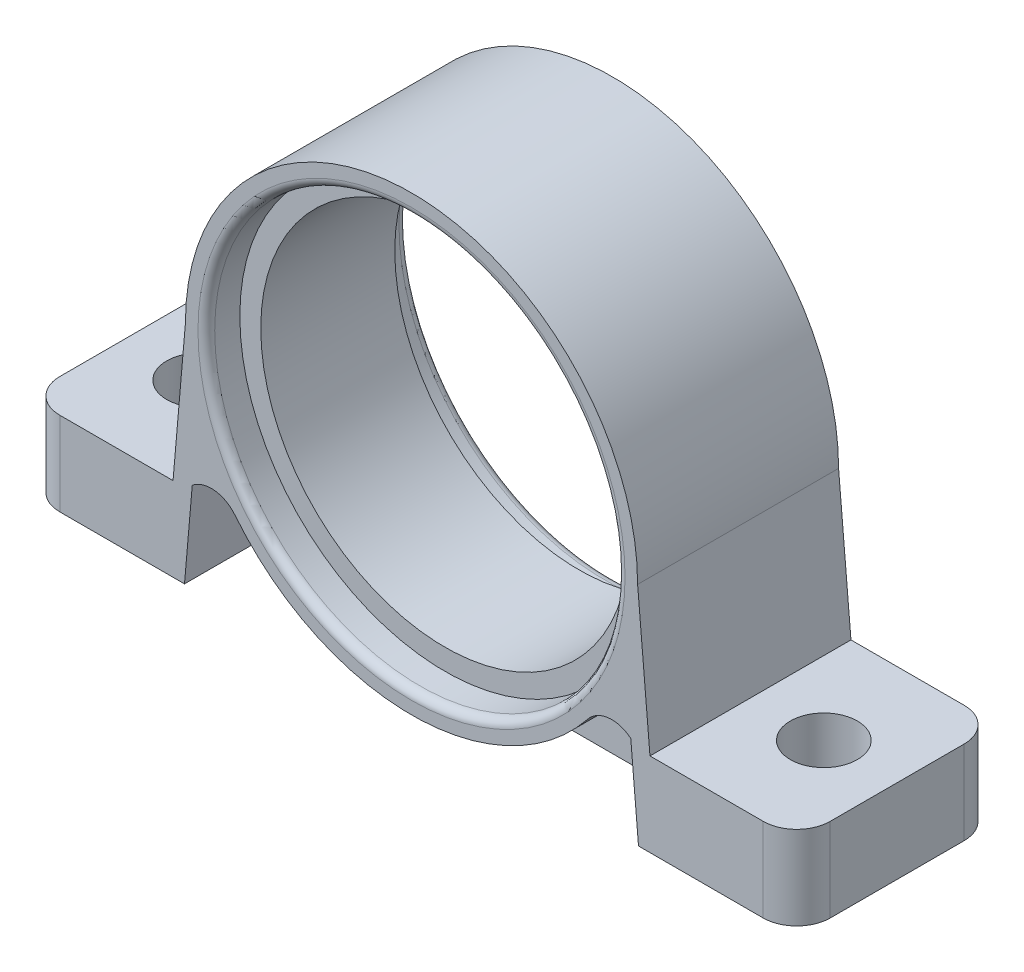
from build123d import *

# Parameters (mm, degrees)
CROQUIS1_R              = 11
SALIENTE_EXTRUIR1_DEPTH = 6
CROQUIS2_R              = 2
CORTAR_EXTRUIR1_DEPTH   = 33.388269481
CORTAR_EXTRUIR2_DEPTH   = 30.244657632
SALIENTE_EXTRUIR2_DEPTH = 2
CROQUIS6_R              = 12.25
CORTAR_EXTRUIR3_DEPTH   = 2
CORTAR_EXTRUIR4_START   = -2
CROQUIS7_R              = 12.25
CORTAR_EXTRUIR4_DEPTH   = 2
REDONDEO1_R             = 2
REDONDEO2_R             = 2
REDONDEO3_R             = 2
REDONDEO4_R             = 0.5


with BuildPart() as part:
    # Croquis1 → Saliente-Extruir1 (new, symmetric)
    with BuildSketch(Plane.XY):
        with BuildLine():
            Line((23, -13.5), (-23, -13.5))
            Line((-23, -13.5), (-23, -8.5))
            Line((-23, -8.5), (-14.237940292, -8.5))
            Line((-14.237940292, -8.5), (-13.5, 0))
            ThreePointArc((-13.5, 0), (0, 13.5), (13.5, 0))
            Line((13.5, 0), (14.237940292, -8.5))
            Line((14.237940292, -8.5), (23, -8.5))
            Line((23, -8.5), (23, -13.5))
        make_face()
        Circle(CROQUIS1_R, mode=Mode.SUBTRACT)
    extrude(amount=SALIENTE_EXTRUIR1_DEPTH, both=True)

    # Croquis2 → Cortar-Extruir1 (cut, through all)
    with BuildSketch(Plane(origin=(0, -8.5, 0), x_dir=(1, 0, 0), z_dir=(0, 1, 0))):
        with Locations(Location((-18.618970146, 0, 0), (0, 0, 270))):
            Circle(CROQUIS2_R)
        with Locations(Location((18.618970146, 0, 0), (0, 0, 90))):
            Circle(CROQUIS2_R)
    extrude(amount=-CORTAR_EXTRUIR1_DEPTH, mode=Mode.SUBTRACT)

    # Croquis3 → Cortar-Extruir2 (cut, through all)
    with BuildSketch(Plane.XY.offset(6)):
        with BuildLine():
            Line((-13.553865986, -13.5), (13.553865986, -13.5))
            Line((13.553865986, -13.5), (13.090777783, -8.165896733))
            ThreePointArc((13.090777783, -8.165896733), (11.758860153, -7.768821091), (10.539573747, -8.435915012))
            ThreePointArc((10.539573747, -8.435915012), (0, -13.499899143), (-10.539573747, -8.435915012))
            ThreePointArc((-10.539573747, -8.435915012), (-11.758860153, -7.768821091), (-13.090777783, -8.165896733))
            Line((-13.090777783, -8.165896733), (-13.553865986, -13.5))
        make_face()
    extrude(amount=-CORTAR_EXTRUIR2_DEPTH, mode=Mode.SUBTRACT)

    # Croquis5 → Saliente-Extruir2 (add, symmetric)
    with BuildSketch(Plane.XY):
        Polygon((-13.553865986, -13.5), (13.553865986, -13.5), (13.090777783, -8.165896733), (11.052644105, -6.744861607), (3.381214515, -12.283091016), (-4.357609146, -12.066622794), (-11.573003147, -6.744861607), (-13.322321885, -7.45537917), align=None)
    extrude(amount=SALIENTE_EXTRUIR2_DEPTH, both=True)

    # Croquis6 → Cortar-Extruir3 (cut)
    with BuildSketch(Plane.XY.offset(6)):
        Circle(CROQUIS6_R)
    extrude(amount=-CORTAR_EXTRUIR3_DEPTH, mode=Mode.SUBTRACT)

    # Croquis7 → Cortar-Extruir4 (cut)
    with BuildSketch(Plane(origin=(0, 0, -6), x_dir=(-1, 0, 0), z_dir=(0, 0, -1)).offset(CORTAR_EXTRUIR4_START)):
        with Locations(Location((0, 0, 0), (0, 0, 180))):
            Circle(CROQUIS7_R)
    extrude(amount=CORTAR_EXTRUIR4_DEPTH, mode=Mode.SUBTRACT)

    # Redondeo1
    redondeo1_edges = [part.edges().sort_by_distance(p)[0] for p in [
        (23, -11, -6),
    ]]
    fillet(redondeo1_edges, radius=REDONDEO1_R)

    # Redondeo2
    redondeo2_edges = [part.edges().sort_by_distance(p)[0] for p in [
        (23, -11, 6),
    ]]
    fillet(redondeo2_edges, radius=REDONDEO2_R)

    # Redondeo3
    redondeo3_edges = [part.edges().sort_by_distance(p)[0] for p in [
        (-23, -11, -6),
        (-23, -11, 6),
    ]]
    fillet(redondeo3_edges, radius=REDONDEO3_R)

    # Redondeo4
    redondeo4_edges = [part.edges().sort_by_distance(p)[0] for p in [
        (-12.25, 0, -6),
        (-12.25, 0, 6),
    ]]
    fillet(redondeo4_edges, radius=REDONDEO4_R)


solid = part.part
